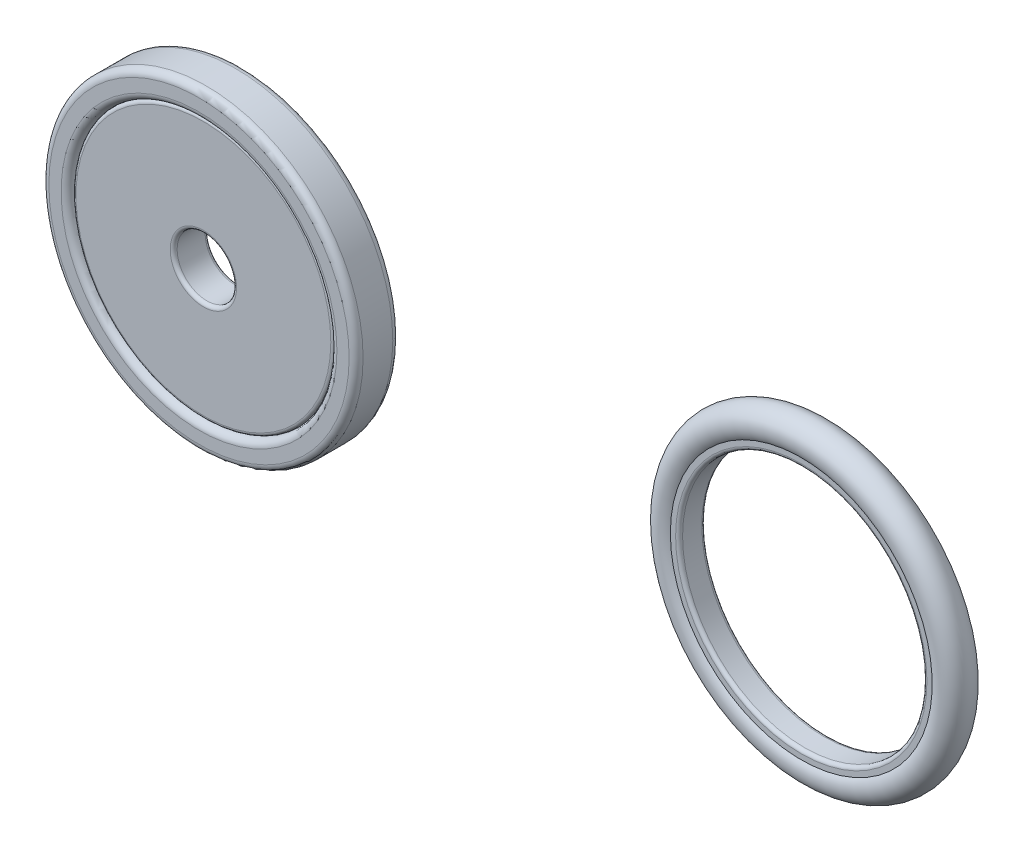
from build123d import *

# Parameters (mm, degrees)
EXTRUDE_944_DEPTH       = 2
EXTRUDE_944_DEPTH_BACK  = 2
SKETCH_913_R            = 15
SKETCH_913_R_2          = 3.4
FILLET_987_R            = 0.4
EXTRUDE_1200_DEPTH      = 2.5
EXTRUDE_1200_DEPTH_BACK = 2.5
SKETCH_877_R            = 18
SKETCH_877_R_2          = 15
FILLET_1238_R           = 0.8
FILLET_1779_R           = 0.4


with BuildPart() as part:
    # Sketch 913 → Extrude 944 (new, two sides: drawn at the far end of the back side and taken through both)
    with BuildSketch(Plane.XY.offset(-EXTRUDE_944_DEPTH_BACK)):
        with Locations((-34.086747616, -13.043319031)):
            Circle(SKETCH_913_R)
        with Locations((-34.086747616, -13.043319031)):
            Circle(SKETCH_913_R_2, mode=Mode.SUBTRACT)
    extrude(amount=EXTRUDE_944_DEPTH + EXTRUDE_944_DEPTH_BACK)

    # Fillet 987
    fillet_987_edges = [part.edges().sort_by_distance(p)[0] for p in [
        (-49.086747616, -13.043319031, -2),
        (-37.486747616, -13.043319031, -2),
        (-49.086747616, -13.043319031, 2),
        (-37.486747616, -13.043319031, 2),
    ]]
    fillet(fillet_987_edges, radius=FILLET_987_R)


with BuildPart() as body_2:
    # Sketch 877 → Extrude 1200 (new, two sides: drawn at the far end of the back side and taken through both)
    with BuildSketch(Plane.XY.offset(-EXTRUDE_1200_DEPTH_BACK)):
        with Locations((-34.086747616, -13.043319031)):
            Circle(SKETCH_877_R)
        with Locations((-34.086747616, -13.043319031)):
            Circle(SKETCH_877_R_2, mode=Mode.SUBTRACT)
    extrude(amount=EXTRUDE_1200_DEPTH + EXTRUDE_1200_DEPTH_BACK)

    # Fillet 1238
    fillet_1238_edges = [body_2.edges().sort_by_distance(p)[0] for p in [
        (-52.086747616, -13.043319031, -2.5),
        (-49.086747616, -13.043319031, -2.5),
        (-52.086747616, -13.043319031, 2.5),
        (-49.086747616, -13.043319031, 2.5),
    ]]
    fillet(fillet_1238_edges, radius=FILLET_1238_R)


with BuildPart() as body_3:
    # 前轮上视图2 → Revolve 1744 (revolve)
    with BuildSketch(Plane(origin=(0, -13.043319031, 0), x_dir=(1, 0, 0), z_dir=(0, 1, 0)), mode=Mode.PRIVATE) as revolve_1744_sk:
        with BuildLine():
            Line((48.913252384, 1.5), (47.913252384, 1.5))
            Line((47.913252384, 1.5), (47.913252384, -1.5))
            Line((47.913252384, -1.5), (48.913252384, -1.5))
            ThreePointArc((48.913252384, -1.5), (51.913252384, 0), (48.913252384, 1.5))
        make_face()
    revolve(revolve_1744_sk.sketch.rotate(Axis((33.913252384, -13.043319031, -9.609887977), (0, 0, 1)), 180), axis=Axis((33.913252384, -13.043319031, -9.609887977), (0, 0, 1)))

    # Fillet 1779
    fillet_1779_edges = [body_3.edges().sort_by_distance(p)[0] for p in [
        (47.913252384, -13.043319031, -1.5),
        (47.913252384, -13.043319031, 1.5),
    ]]
    fillet(fillet_1779_edges, radius=FILLET_1779_R)


solid = Compound([part.part, body_2.part, body_3.part])
